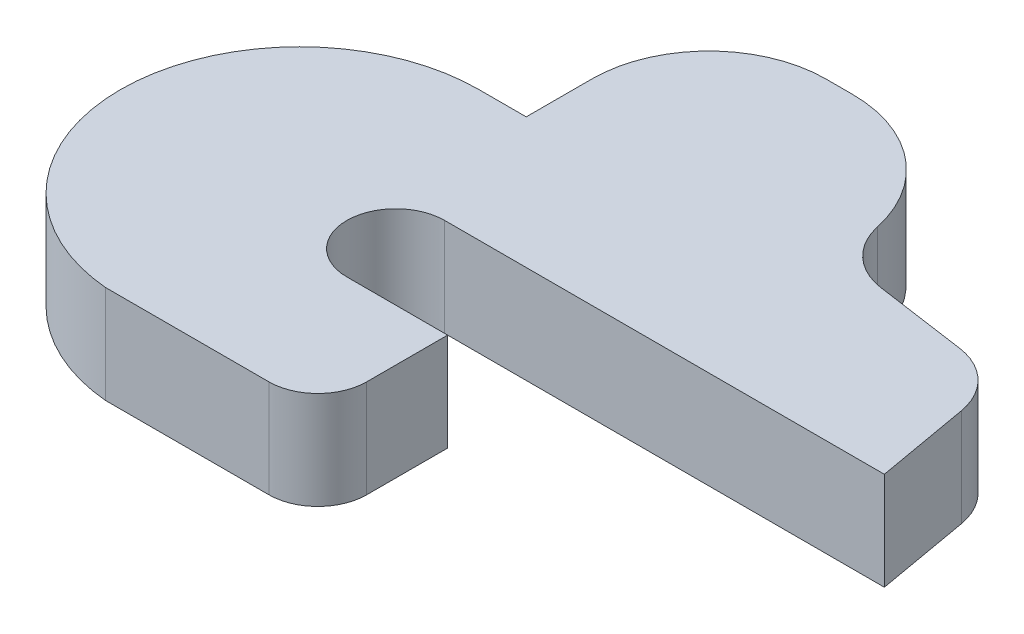
from build123d import *

# Parameters (mm, degrees)
BOSS_EXTRUDE2_DEPTH = 3


with BuildPart() as part:
    # Sketch1 → Boss-Extrude2 (new body)
    with BuildSketch(Plane(origin=(0, 0, 0), x_dir=(1, 0, 0), z_dir=(0, 1, 0))):
        with BuildLine():
            Line((0, 0), (-3.09, 0))
            ThreePointArc((-3.09, 0), (-4.59, 1.5), (-3.09, 3))
            Line((-3.09, 3), (10.39, 3))
            Line((10.39, 3), (9.884407499, 5.867357559))
            ThreePointArc((9.884407499, 5.867357559), (9.305640068, 6.957260436), (8.197355905, 7.5))
            Line((8.197355905, 7.5), (5.39, 7.900647469))
            ThreePointArc((5.39, 7.900647469), (4.311140868, 8.415483097), (3.718647651, 9.453724177))
            ThreePointArc((3.718647651, 9.453724177), (2.319311021, 11.715677832), (-0.189184873, 12.6))
            Line((-0.189184873, 12.6), (-1, 12.6))
            ThreePointArc((-1, 12.6), (-3.538513344, 11.548513344), (-4.59, 9.01))
            Line((-4.59, 9.01), (-4.59, 7))
            Line((-4.59, 7), (-6.035002275, 7))
            ThreePointArc((-6.035002275, 7), (-11.53, 1.734520788), (-6.503617255, -3.98))
            Line((-6.503617255, -3.98), (-1.5, -3.98))
            ThreePointArc((-1.5, -3.98), (-0.439339828, -3.540660172), (0, -2.48))
            Line((0, -2.48), (0, 0))
        make_face()
    extrude(amount=BOSS_EXTRUDE2_DEPTH)


solid = part.part
